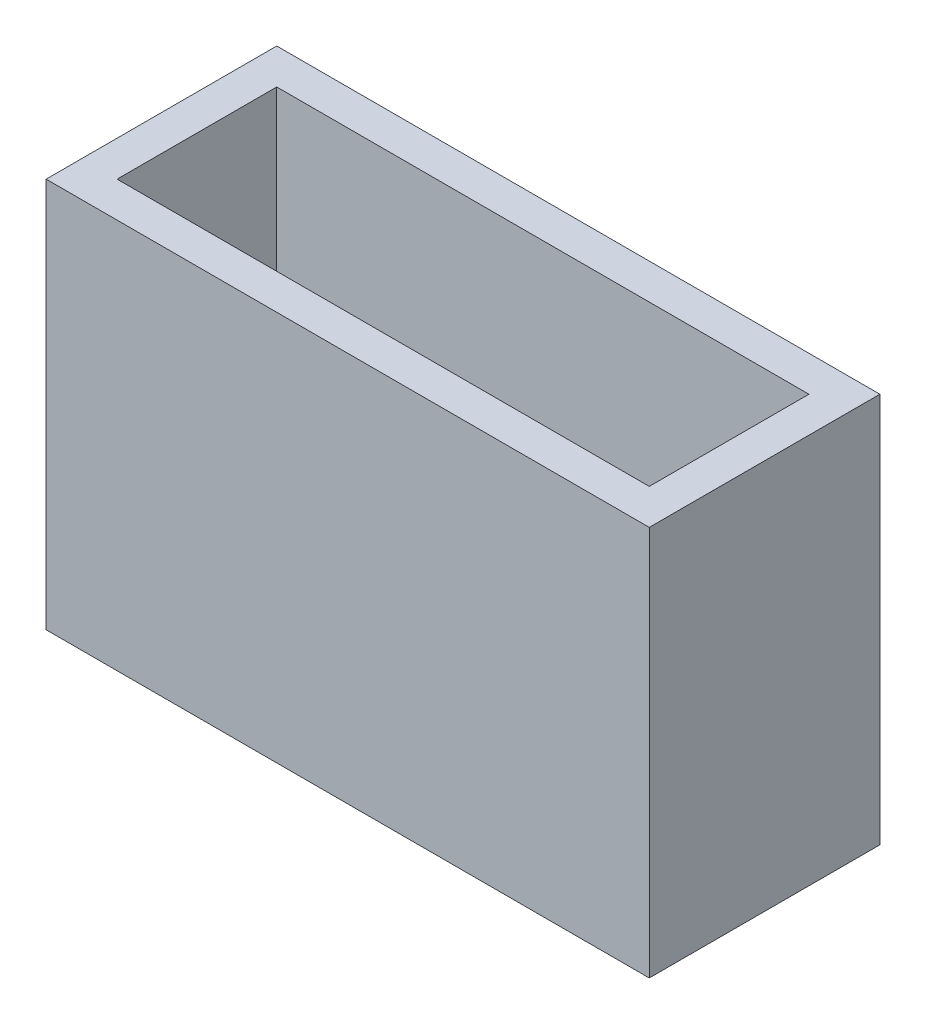
from build123d import *

# Parameters (mm, degrees)
SKETCH1_W           = 340
SKETCH1_H           = 130
SKETCH1_W_2         = 300
SKETCH1_H_2         = 90
BOSS_EXTRUDE1_DEPTH = 220
SKETCH1_2_W         = 340
SKETCH1_2_H         = 130
SKETCH1_2_W_2       = 300
SKETCH1_2_H_2       = 90
BOSS_EXTRUDE2_DEPTH = 220
BOSS_EXTRUDE3_REACH = 412.152
SKETCH2_W           = 130
SKETCH2_H           = 11.669014553


with BuildPart() as part:
    # Sketch1 → Boss-Extrude1 (new body)
    with BuildSketch(Plane(origin=(0, 0, 0), x_dir=(1, 0, 0), z_dir=(0, 1, 0))):
        Rectangle(SKETCH1_W, SKETCH1_H)
        Rectangle(SKETCH1_W_2, SKETCH1_H_2, mode=Mode.SUBTRACT)
    extrude(amount=BOSS_EXTRUDE1_DEPTH)

    # Sketch1<2> → Boss-Extrude2 (add)
    with BuildSketch(Plane(origin=(0, 0, 0), x_dir=(1, 0, 0), z_dir=(0, 1, 0))):
        Rectangle(SKETCH1_2_W, SKETCH1_2_H)
        Rectangle(SKETCH1_2_W_2, SKETCH1_2_H_2, mode=Mode.SUBTRACT)
    extrude(amount=BOSS_EXTRUDE2_DEPTH)

    # Sketch2 → Boss-Extrude3 (add, up to next)
    with BuildSketch(Plane.ZY.offset(170), mode=Mode.PRIVATE) as boss_extrude3_sk1:
        with Locations((0, 5.834507277)):
            Rectangle(SKETCH2_W, SKETCH2_H)
    boss_extrude3_tool1 = extrude(boss_extrude3_sk1.sketch, amount=-BOSS_EXTRUDE3_REACH, mode=Mode.PRIVATE) - part.part
    add(boss_extrude3_tool1.solids().sort_by_distance((-170, 5.834507, 0))[0])


solid = part.part
